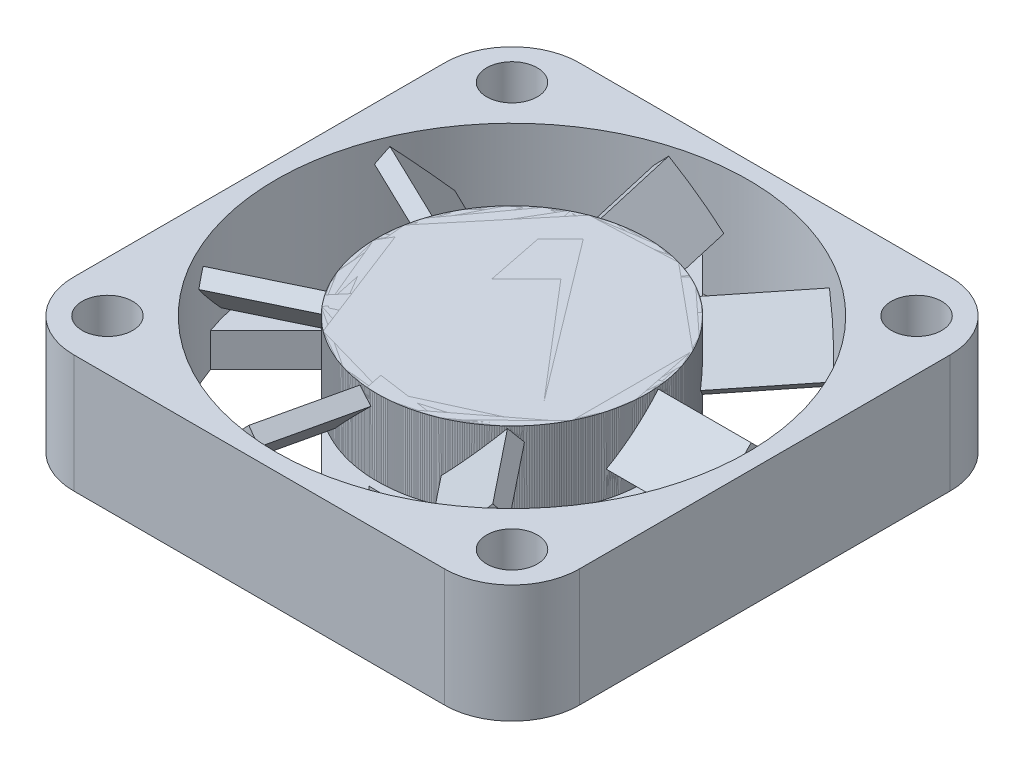
from build123d import *

# Parameters (mm, degrees)
SKETCH1_R                = 14
SKETCH1_R_2              = 1.5
BOSS_EXTRUDE1_DEPTH      = 7
BOSS_EXTRUDE2_DEPTH      = 2
SKETCH3_R                = 8
BOSS_EXTRUDE3_DEPTH      = 4.5
BOSS_EXTRUDE4_REACH      = 24.338
BOSS_EXTRUDE4_END_RADIUS = 13.5
CIRPATTERN3_COUNT        = 7


with BuildPart() as part:
    # Sketch1 → Boss-Extrude1 (new body)
    with BuildSketch(Plane(origin=(0, 0, 0), x_dir=(1, 0, 0), z_dir=(0, 1, 0))):
        with BuildLine():
            Line((-11, 15), (11, 15))
            ThreePointArc((11, 15), (13.828427125, 13.828427125), (15, 11))
            Line((15, 11), (15, -11))
            ThreePointArc((15, -11), (13.828427125, -13.828427125), (11, -15))
            Line((11, -15), (-11, -15))
            ThreePointArc((-11, -15), (-13.828427125, -13.828427125), (-15, -11))
            Line((-15, -11), (-15, 11))
            ThreePointArc((-15, 11), (-13.828427125, 13.828427125), (-11, 15))
        make_face()
        with Locations(Location((0, 0, 0), (0, 0, 270))):
            Circle(SKETCH1_R, mode=Mode.SUBTRACT)
        with Locations(Location((-12, 12, 0), (0, 0, 270))):
            Circle(SKETCH1_R_2, mode=Mode.SUBTRACT)
        with Locations(Location((12, 12, 0), (0, 0, 270))):
            Circle(SKETCH1_R_2, mode=Mode.SUBTRACT)
        with Locations(Location((12, -12, 0), (0, 0, 270))):
            Circle(SKETCH1_R_2, mode=Mode.SUBTRACT)
        with Locations(Location((-12, -12, 0), (0, 0, 270))):
            Circle(SKETCH1_R_2, mode=Mode.SUBTRACT)
    extrude(amount=BOSS_EXTRUDE1_DEPTH)

    # Sketch2 → Boss-Extrude2 (add)
    with BuildSketch(Plane.XZ):
        with BuildLine():
            Line((-5.656854249, 5.656854249), (2.467184155, 13.780892654))
            ThreePointArc((2.467184155, 13.780892654), (3.596690362, 13.53010785), (4.701631223, 13.186912597))
            Line((4.701631223, 13.186912597), (-0.5009833, 7.984298074))
            ThreePointArc((-0.5009833, 7.984298074), (2.828427125, 7.483314774), (5.656854249, 5.656854249))
            Line((5.656854249, 5.656854249), (13.780892654, -2.467184155))
            ThreePointArc((13.780892654, -2.467184155), (13.53010785, -3.596690362), (13.186912597, -4.701631223))
            Line((13.186912597, -4.701631223), (7.984298074, 0.5009833))
            ThreePointArc((7.984298074, 0.5009833), (7.483314774, -2.828427125), (5.656854249, -5.656854249))
            Line((5.656854249, -5.656854249), (-2.467184155, -13.780892654))
            ThreePointArc((-2.467184155, -13.780892654), (-3.596690362, -13.53010785), (-4.701631223, -13.186912597))
            Line((-4.701631223, -13.186912597), (0.5009833, -7.984298074))
            ThreePointArc((0.5009833, -7.984298074), (-2.828427125, -7.483314774), (-5.656854249, -5.656854249))
            Line((-5.656854249, -5.656854249), (-13.780892654, 2.467184155))
            ThreePointArc((-13.780892654, 2.467184155), (-13.53010785, 3.596690362), (-13.186912597, 4.701631223))
            Line((-13.186912597, 4.701631223), (-7.984298074, -0.5009833))
            ThreePointArc((-7.984298074, -0.5009833), (-7.483314774, 2.828427125), (-5.656854249, 5.656854249))
        make_face()
    extrude(amount=-BOSS_EXTRUDE2_DEPTH)


with BuildPart() as body_2:
    # Sketch3 → Boss-Extrude3 (new body)
    with BuildSketch(Plane(origin=(0, 7, 0), x_dir=(1, 0, 0), z_dir=(0, 1, 0))):
        with Locations(Location((0, 0, 0), (0, 0, 270))):
            Circle(SKETCH3_R)
    extrude(amount=-BOSS_EXTRUDE3_DEPTH)

    # Boss-Extrude4: up to this cylinder (the profile starts inside it)
    boss_extrude4_end = Plane(origin=(0, 5.103553, 0), z_dir=(0, -1, 0)) * Cylinder(BOSS_EXTRUDE4_END_RADIUS, 76.676, mode=Mode.PRIVATE)
    # Sketch4 → Boss-Extrude4 (add, up to the surface)
    with BuildSketch(Plane(origin=(0, 0, 0), x_dir=(0, 0, -1), z_dir=(1, 0, 0)), mode=Mode.PRIVATE) as boss_extrude4_sk1:
        Polygon((-2.121320344, 4.042893219), (0.707106781, 6.871320344), (1.414213562, 6.164213562), (-1.414213562, 3.335786438), align=None)
    boss_extrude4_tool1 = extrude(boss_extrude4_sk1.sketch, amount=BOSS_EXTRUDE4_REACH, mode=Mode.PRIVATE) & boss_extrude4_end
    add(boss_extrude4_tool1.solids().sort_by_distance((0, 5.103553, 0.353553))[0])


with BuildPart() as cirpattern3_1:
    # CirPattern3: pattern copy
    add(body_2.part.rotate(Axis((0, 0, 0), (0, 1, 0)), 1 * 360 / CIRPATTERN3_COUNT))


with BuildPart() as cirpattern3_2:
    # CirPattern3: pattern copy
    add(body_2.part.rotate(Axis((0, 0, 0), (0, 1, 0)), 2 * 360 / CIRPATTERN3_COUNT))


with BuildPart() as cirpattern3_3:
    # CirPattern3: pattern copy
    add(body_2.part.rotate(Axis((0, 0, 0), (0, 1, 0)), 3 * 360 / CIRPATTERN3_COUNT))


with BuildPart() as cirpattern3_4:
    # CirPattern3: pattern copy
    add(body_2.part.rotate(Axis((0, 0, 0), (0, 1, 0)), 4 * 360 / CIRPATTERN3_COUNT))


with BuildPart() as cirpattern3_5:
    # CirPattern3: pattern copy
    add(body_2.part.rotate(Axis((0, 0, 0), (0, 1, 0)), 5 * 360 / CIRPATTERN3_COUNT))


with BuildPart() as cirpattern3_6:
    # CirPattern3: pattern copy
    add(body_2.part.rotate(Axis((0, 0, 0), (0, 1, 0)), 6 * 360 / CIRPATTERN3_COUNT))


solid = Compound([part.part, body_2.part, cirpattern3_1.part, cirpattern3_2.part, cirpattern3_3.part, cirpattern3_4.part, cirpattern3_5.part, cirpattern3_6.part])
